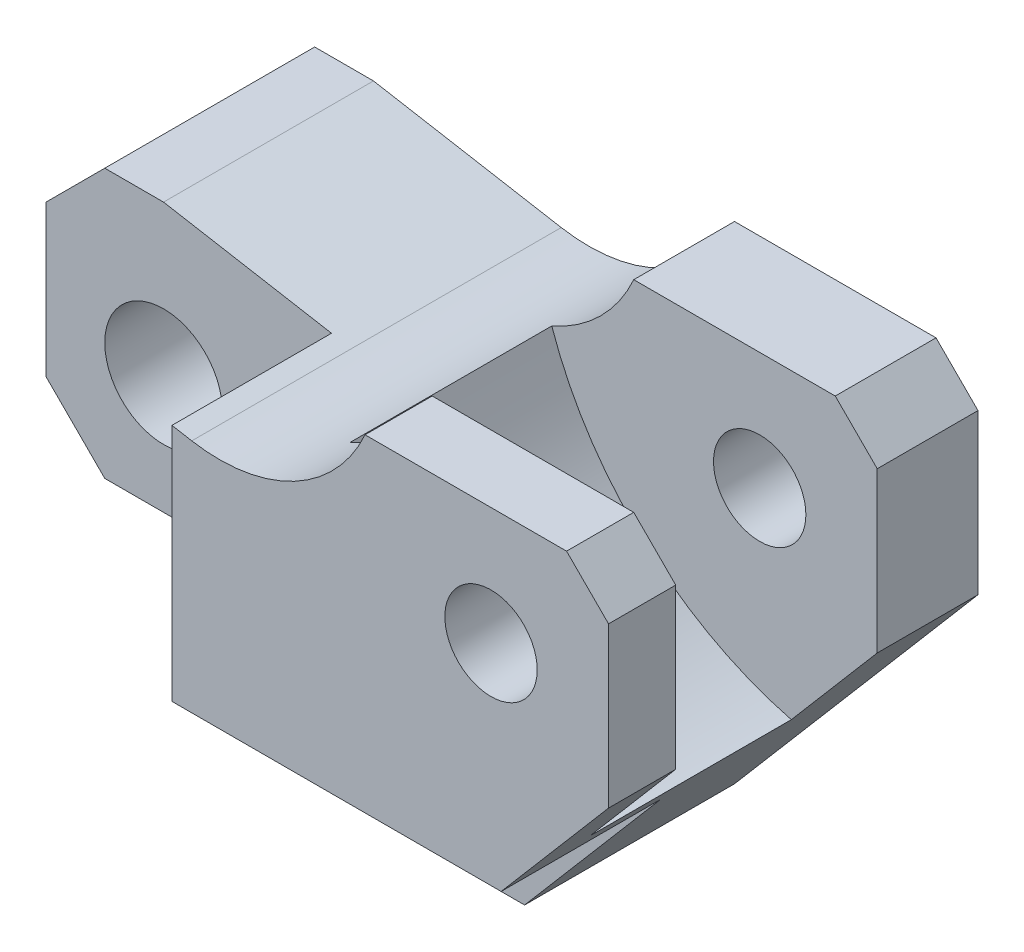
from build123d import *

# Parameters (mm, degrees)
SKETCH1_R           = 7
BOSS_EXTRUDE1_DEPTH = 44
SKETCH3_R           = 41
CUT_EXTRUDE1_DEPTH  = 24
SKETCH4_W           = 19
SKETCH4_H           = 19
CUT_EXTRUDE2_DEPTH  = 105.177732746
SKETCH5_W           = 34
SKETCH5_H           = 32
CUT_EXTRUDE4_DEPTH  = 19
SKETCH6_R           = 5.5
CUT_EXTRUDE5_DEPTH  = 105.177732746


with BuildPart() as part:
    # Sketch1 → Boss-Extrude1 (new body)
    with BuildSketch(Plane.XY):
        with BuildLine():
            Line((0, 7), (0, 25))
            Line((0, 25), (7, 32))
            Line((7, 32), (14, 32))
            Line((14, 32), (36.361380836, 28.057085233))
            ThreePointArc((36.361380836, 28.057085233), (48.561098706, 29.982044142), (57, 39))
            Line((57, 39), (81, 39))
            Line((81, 39), (86, 34))
            Line((86, 34), (86, 15))
            Line((86, 15), (57, -19))
            Line((57, -19), (51.296980053, -19))
            ThreePointArc((51.296980053, -19), (46.858007856, -12.115672061), (44.521177653, -4.264705882))
            ThreePointArc((44.521177653, -4.264705882), (42.840774692, -1.213413768), (39.575538911, 0))
            Line((39.575538911, 0), (7, 0))
            Line((7, 0), (0, 7))
        make_face()
        with Locations((14, 14)):
            Circle(SKETCH1_R, mode=Mode.SUBTRACT)
    extrude(amount=BOSS_EXTRUDE1_DEPTH)

    # Sketch3 → Cut-Extrude1 (cut)
    with BuildSketch(Plane(origin=(0, 0, 12), x_dir=(-1, 0, 0), z_dir=(0, 0, -1))):
        with Locations((-86, 42.701873436)):
            Circle(SKETCH3_R)
    extrude(amount=-CUT_EXTRUDE1_DEPTH, mode=Mode.SUBTRACT)

    # Sketch4 → Cut-Extrude2 (cut, through all)
    with BuildSketch(Plane(origin=(86, 0, 0), x_dir=(0, 0, -1), z_dir=(1, 0, 0))):
        with Locations((-34.5, -9.5)):
            Rectangle(SKETCH4_W, SKETCH4_H)
    extrude(amount=-CUT_EXTRUDE2_DEPTH, mode=Mode.SUBTRACT)

    # Sketch5 → Cut-Extrude4 (cut)
    with BuildSketch(Plane.XY.offset(44)):
        with Locations((17, 16)):
            Rectangle(SKETCH5_W, SKETCH5_H)
    extrude(amount=-CUT_EXTRUDE4_DEPTH, mode=Mode.SUBTRACT)

    # Sketch6 → Cut-Extrude5 (cut, through all)
    with BuildSketch(Plane.XY.offset(44)):
        with Locations((72, 25)):
            Circle(SKETCH6_R)
    extrude(amount=-CUT_EXTRUDE5_DEPTH, mode=Mode.SUBTRACT)


solid = part.part
